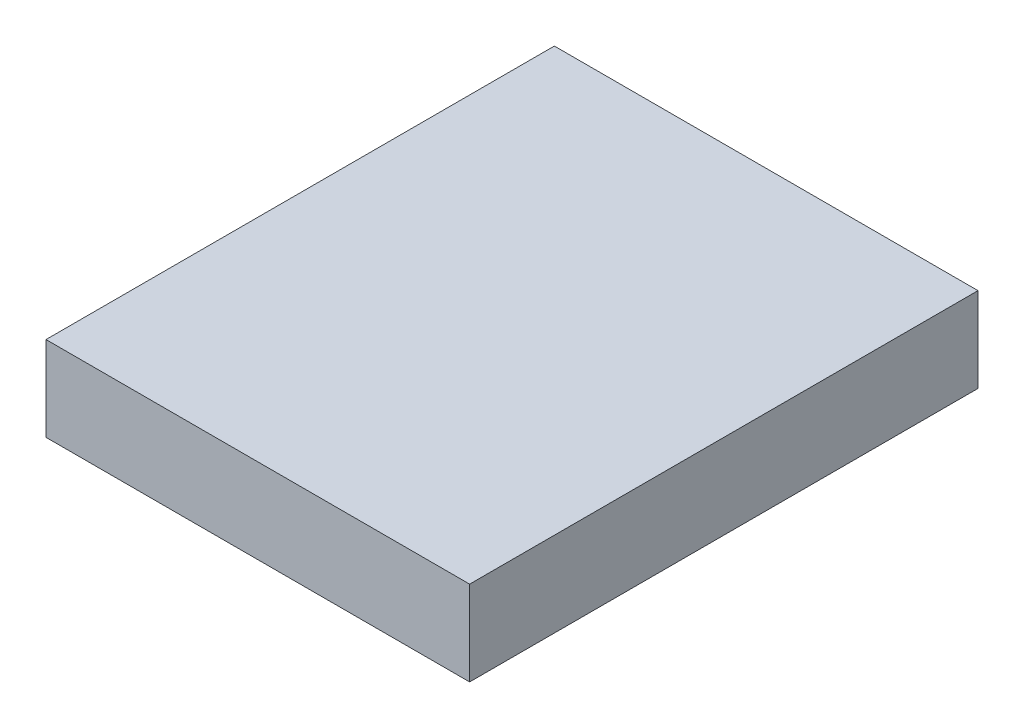
from build123d import *

# Parameters (mm, degrees)
SKETCH_1_W      = 100
SKETCH_1_H      = 20
EXTRUDE_1_DEPTH = 120


with BuildPart() as part:
    # 草图1 → 凸台-拉伸1 (new body)
    with BuildSketch(Plane.XY):
        Rectangle(SKETCH_1_W, SKETCH_1_H)
    extrude(amount=EXTRUDE_1_DEPTH)


solid = part.part
